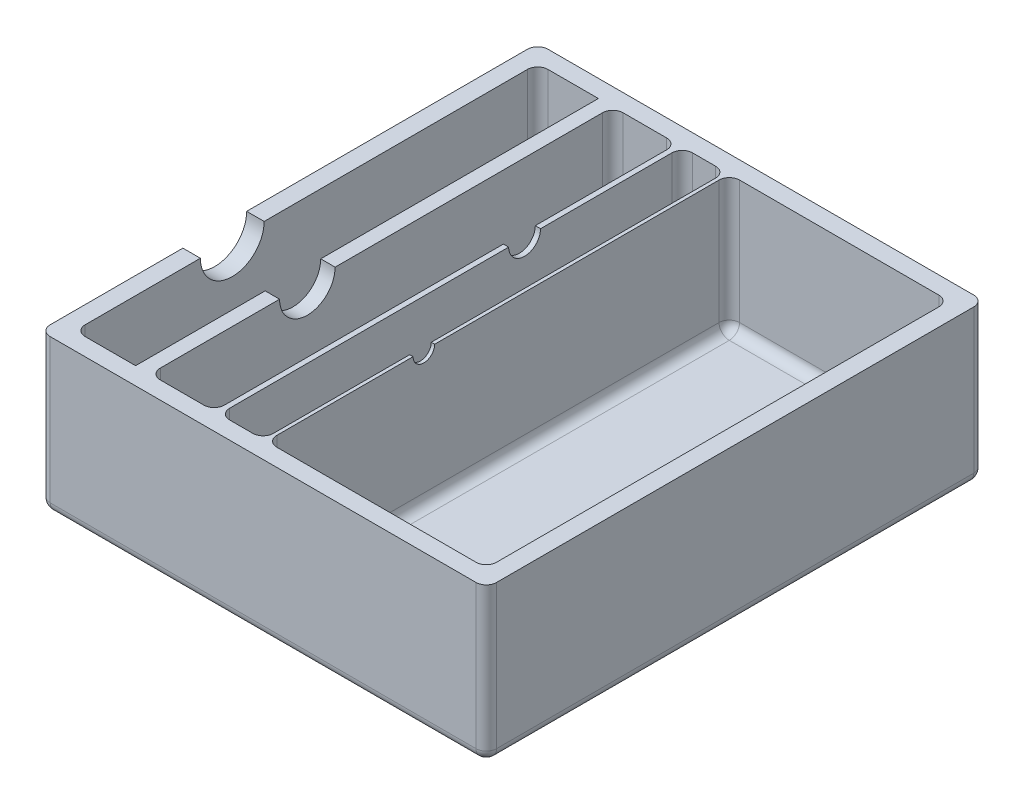
from build123d import *

# Parameters (mm, degrees)
SKETCH2_W           = 4000
SKETCH2_H           = 4500
BOSS_EXTRUDE1_DEPTH = 200
SKETCH5_W           = 4340
SKETCH5_H           = 4840
SKETCH5_W_2         = 4000
SKETCH5_H_2         = 4500
BOSS_EXTRUDE2_DEPTH = 1500
SKETCH6_W           = 140
SKETCH6_H           = 4500
SKETCH6_W_2         = 51
SKETCH6_W_3         = 33
BOSS_EXTRUDE4_DEPTH = 1300
CUT_EXTRUDE1_REACH  = 5192.568
SKETCH7_R           = 310
CUT_EXTRUDE2_REACH  = 4576.145
SKETCH8_R           = 270
CUT_EXTRUDE3_REACH  = 3687.377
SKETCH9_R           = 105
CUT_EXTRUDE4_REACH  = 4006.529
SKETCH10_R          = 155
FILLET1_R           = 100


with BuildPart() as part:
    # Sketch2 → Boss-Extrude1 (new body)
    with BuildSketch(Plane(origin=(0, 0, 0), x_dir=(1, 0, 0), z_dir=(0, 1, 0))):
        Rectangle(SKETCH2_W, SKETCH2_H)
    extrude(amount=BOSS_EXTRUDE1_DEPTH)

    # Sketch5 → Boss-Extrude2 (add)
    with BuildSketch(Plane(origin=(0, 0, 0), x_dir=(1, 0, 0), z_dir=(0, 1, 0))):
        Rectangle(SKETCH5_W, SKETCH5_H)
        Rectangle(SKETCH5_W_2, SKETCH5_H_2, mode=Mode.SUBTRACT)
    extrude(amount=BOSS_EXTRUDE2_DEPTH)

    # Sketch6 → Boss-Extrude4 (add)
    with BuildSketch(Plane(origin=(0, 200, 0), x_dir=(1, 0, 0), z_dir=(0, 1, 0))):
        with Locations((-1340, 0)):
            Rectangle(SKETCH6_W, SKETCH6_H)
        with Locations((-620.5, 0)):
            Rectangle(SKETCH6_W_2, SKETCH6_H)
        with Locations((-153.5, 0)):
            Rectangle(SKETCH6_W_3, SKETCH6_H)
    extrude(amount=BOSS_EXTRUDE4_DEPTH)

    # Sketch7 → Cut-Extrude1 (cut, up to next)
    with BuildSketch(Plane.ZY.offset(2170), mode=Mode.PRIVATE) as cut_extrude1_sk1:
        with Locations((720, 1500)):
            Circle(SKETCH7_R)
    cut_extrude1_tool1 = extrude(cut_extrude1_sk1.sketch, amount=-CUT_EXTRUDE1_REACH, mode=Mode.PRIVATE) & part.part
    add(cut_extrude1_tool1.solids().sort_by_distance((-2170, 1500, 720))[0], mode=Mode.SUBTRACT)

    # Sketch8 → Cut-Extrude2 (cut, up to next)
    with BuildSketch(Plane.ZY.offset(1410), mode=Mode.PRIVATE) as cut_extrude2_sk1:
        with Locations((720, 1500)):
            Circle(SKETCH8_R)
    cut_extrude2_tool1 = extrude(cut_extrude2_sk1.sketch, amount=-CUT_EXTRUDE2_REACH, mode=Mode.PRIVATE) & part.part
    add(cut_extrude2_tool1.solids().sort_by_distance((-1410, 1500, 720))[0], mode=Mode.SUBTRACT)

    # Sketch9 → Cut-Extrude3 (cut, up to next)
    with BuildSketch(Plane.ZY.offset(170), mode=Mode.PRIVATE) as cut_extrude3_sk1:
        with Locations((720, 1500)):
            Circle(SKETCH9_R)
    cut_extrude3_tool1 = extrude(cut_extrude3_sk1.sketch, amount=-CUT_EXTRUDE3_REACH, mode=Mode.PRIVATE) & part.part
    add(cut_extrude3_tool1.solids().sort_by_distance((-170, 1500, 720))[0], mode=Mode.SUBTRACT)

    # Sketch10 → Cut-Extrude4 (cut, up to next)
    with BuildSketch(Plane.ZY.offset(646), mode=Mode.PRIVATE) as cut_extrude4_sk1:
        with Locations((-717.5, 1500)):
            Circle(SKETCH10_R)
    cut_extrude4_tool1 = extrude(cut_extrude4_sk1.sketch, amount=-CUT_EXTRUDE4_REACH, mode=Mode.PRIVATE) & part.part
    add(cut_extrude4_tool1.solids().sort_by_distance((-646, 1500, -717.5))[0], mode=Mode.SUBTRACT)

    # Fillet1
    fillet1_edges = [part.edges().sort_by_distance(p)[0] for p in [
        (-2000, 200, 0),
        (2000, 850, -2250),
        (-2000, 850, -2250),
        (-2000, 850, 2250),
        (2000, 850, 2250),
        (-1705, 200, 2250),
        (-2170, 0, 0),
        (-2170, 750, -2420),
        (0, 0, 2420),
        (-2170, 750, 2420),
        (2170, 0, 0),
        (2170, 750, 2420),
        (0, 0, -2420),
        (2170, 750, -2420),
        (-958, 200, 2250),
        (-1705, 200, -2250),
        (-1410, 200, 0),
        (-1270, 850, 2250),
        (-1270, 200, 0),
        (-1270, 850, -2250),
        (2000, 200, 0),
        (-382.5, 200, 2250),
        (-958, 200, -2250),
        (-646, 850, -2250),
        (-646, 200, 0),
        (-646, 850, 2250),
        (-595, 850, 2250),
        (-595, 200, 0),
        (-595, 850, -2250),
        (931.5, 200, 2250),
        (-382.5, 200, -2250),
        (-170, 850, -2250),
        (-170, 200, 0),
        (-170, 850, 2250),
        (-137, 850, 2250),
        (-137, 200, 0),
        (-137, 850, -2250),
        (931.5, 200, -2250),
    ]]
    fillet(fillet1_edges, radius=FILLET1_R)


solid = part.part
